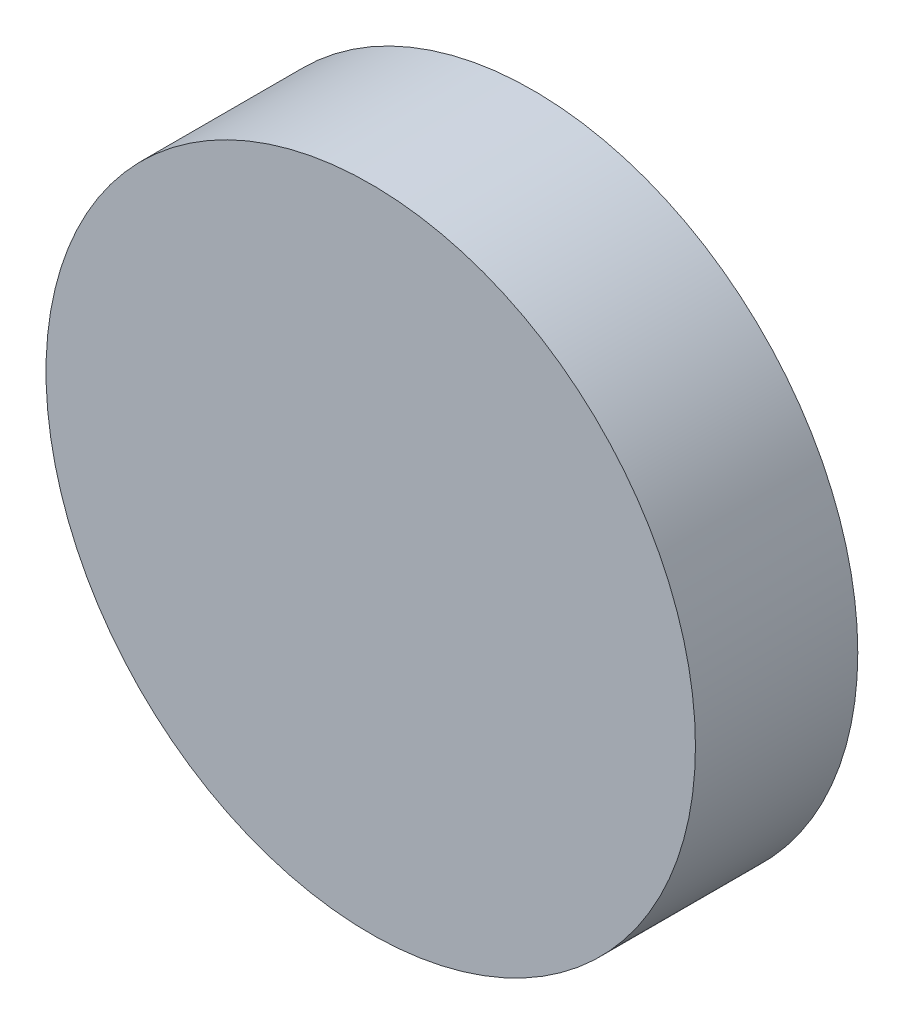
from build123d import *

# Parameters (mm, degrees)
ESBO_O1_R                = 4
RESSALTO_EXTRUS_O1_DEPTH = 2


with BuildPart() as part:
    # Esboço1 → Ressalto-extrusão1 (new body)
    with BuildSketch(Plane.XY):
        Circle(ESBO_O1_R)
    extrude(amount=RESSALTO_EXTRUS_O1_DEPTH)


solid = part.part
